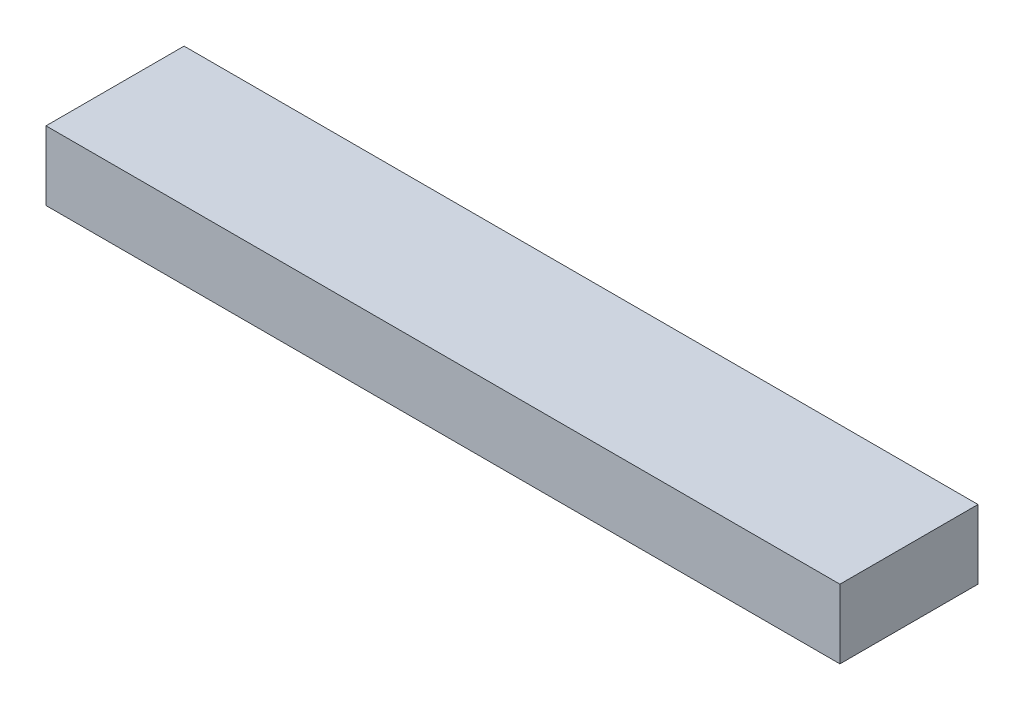
from build123d import *

# Parameters (mm, degrees)
SKETCH1_W           = 23
SKETCH1_H           = 4
BOSS_EXTRUDE1_DEPTH = 2


with BuildPart() as part:
    # Sketch1 → Boss-Extrude1 (new body)
    with BuildSketch(Plane(origin=(0, 0, 0), x_dir=(1, 0, 0), z_dir=(0, 1, 0))):
        Rectangle(SKETCH1_W, SKETCH1_H)
    extrude(amount=BOSS_EXTRUDE1_DEPTH)


solid = part.part
